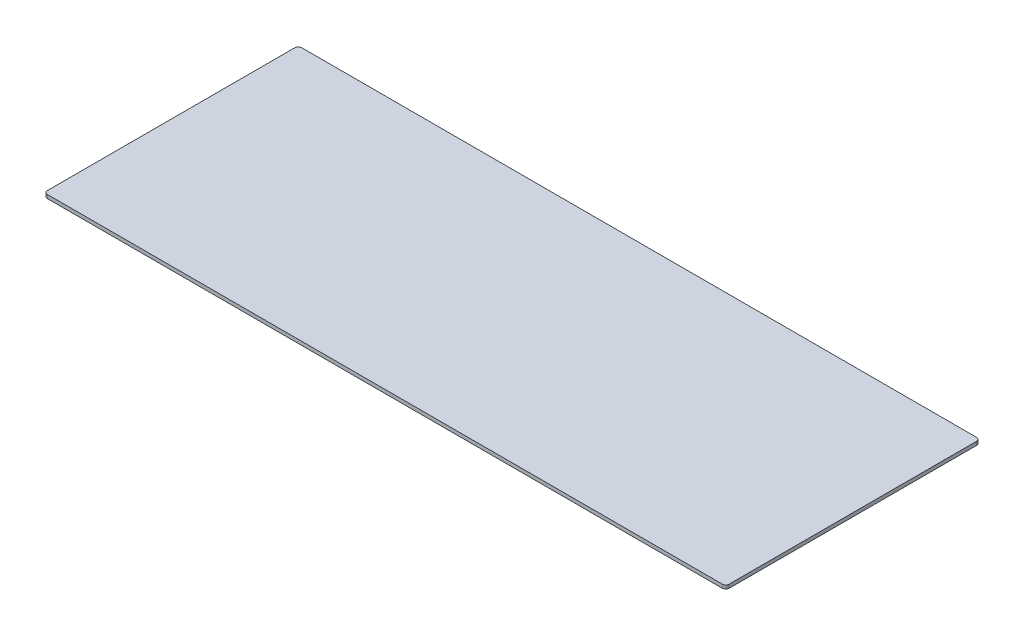
from build123d import *

# Parameters (mm, degrees)
SKETCH_1_W      = 303
SKETCH_1_H      = 113
EXTRUDE_1_DEPTH = 1.6
FILLET_1_R      = 1.5


with BuildPart() as part:
    # 草图1 → 凸台-拉伸1 (new body)
    with BuildSketch(Plane(origin=(0, 0, 0), x_dir=(1, 0, 0), z_dir=(0, 1, 0))):
        with Locations((176.780625722, -56.5)):
            Rectangle(SKETCH_1_W, SKETCH_1_H)
    extrude(amount=EXTRUDE_1_DEPTH)

    # 圆角1
    fillet_1_edges = [part.edges().sort_by_distance(p)[0] for p in [
        (25.280625722, 0.8, 0),
        (328.280625722, 0.8, 0),
        (328.280625722, 0.8, 113),
        (25.280625722, 0.8, 113),
    ]]
    fillet(fillet_1_edges, radius=FILLET_1_R)


solid = part.part
